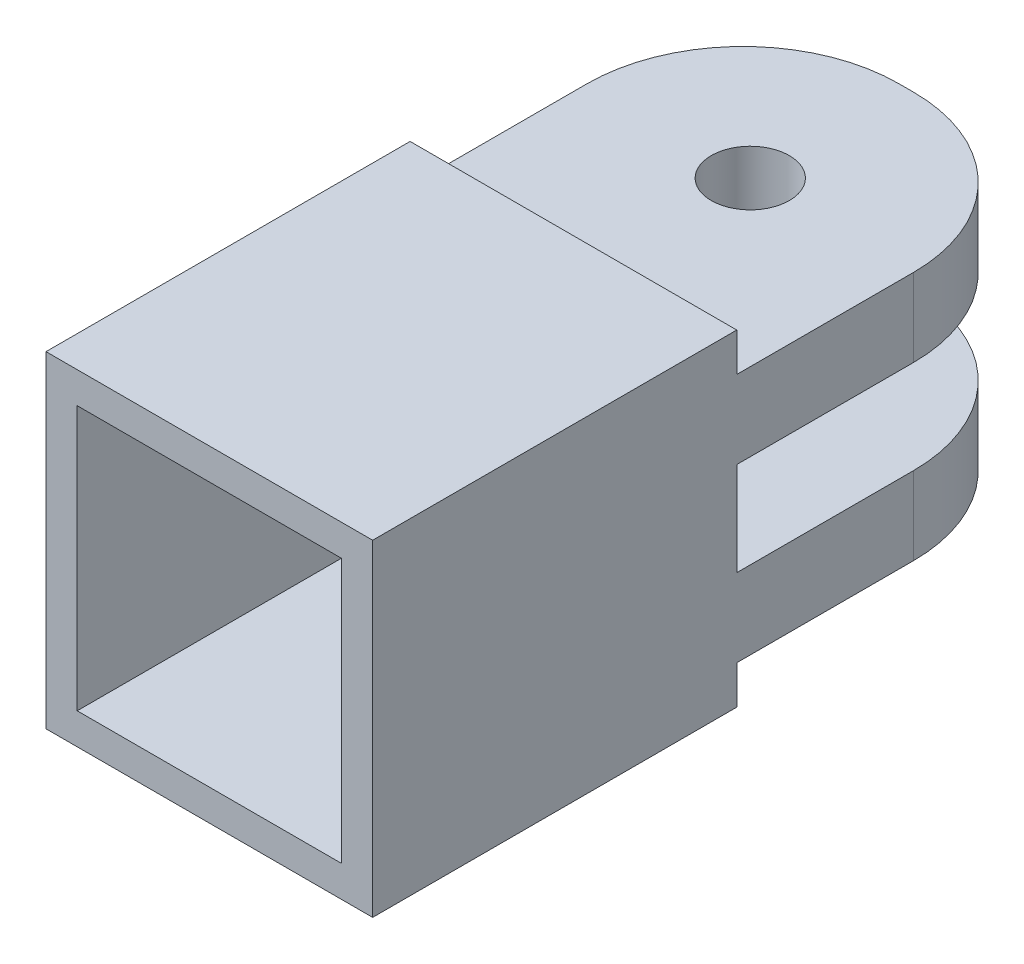
from build123d import *

# Parameters (mm, degrees)
SKETCH1_W           = 31.4
SKETCH1_H           = 31.4
SKETCH1_W_2         = 25.4
SKETCH1_H_2         = 25.4
BOSS_EXTRUDE1_DEPTH = 30
SKETCH2_W           = 31.4
SKETCH2_H           = 31.4
BOSS_EXTRUDE2_DEPTH = 5
SKETCH3_W           = 31.4
SKETCH3_H           = 7.5
BOSS_EXTRUDE3_DEPTH = 5
SKETCH6_R           = 3.75
BOSS_EXTRUDE6_DEPTH = 7.5


with BuildPart() as part:
    # Sketch1 → Boss-Extrude1 (new body)
    with BuildSketch(Plane.XY):
        Rectangle(SKETCH1_W, SKETCH1_H)
        Rectangle(SKETCH1_W_2, SKETCH1_H_2, mode=Mode.SUBTRACT)
    extrude(amount=BOSS_EXTRUDE1_DEPTH)

    # Sketch2 → Boss-Extrude2 (add)
    with BuildSketch(Plane(origin=(0, 0, 0), x_dir=(-1, 0, 0), z_dir=(0, 0, -1))):
        Rectangle(SKETCH2_W, SKETCH2_H)
    extrude(amount=BOSS_EXTRUDE2_DEPTH)

    # Sketch3 → Boss-Extrude3 (add)
    with BuildSketch(Plane(origin=(0, 0, -5), x_dir=(-1, 0, 0), z_dir=(0, 0, -1))):
        with Locations((0, 8.25)):
            Rectangle(SKETCH3_W, SKETCH3_H)
    boss_extrude3 = extrude(amount=BOSS_EXTRUDE3_DEPTH)

    # Sketch6 → Boss-Extrude6 (add)
    with BuildSketch(Plane(origin=(0, 12, 0), x_dir=(1, 0, 0), z_dir=(0, 1, 0))):
        with BuildLine():
            Line((-15.7, 10), (-15.7, 22))
            ThreePointArc((-15.7, 22), (-11.306601718, 32.606601718), (-0.7, 37))
            Line((-0.7, 37), (0.7, 37))
            ThreePointArc((0.7, 37), (11.306601718, 32.606601718), (15.7, 22))
            Line((15.7, 22), (15.7, 10))
            Line((15.7, 10), (-15.7, 10))
        make_face()
        with Locations(Location((0, 22, 0), (0, 0, 270))):
            Circle(SKETCH6_R, mode=Mode.SUBTRACT)
    boss_extrude6 = extrude(amount=-BOSS_EXTRUDE6_DEPTH)

    # Mirror1: Boss-Extrude3, Boss-Extrude6 across plane
    add(boss_extrude3.mirror(Plane.ZX))
    add(boss_extrude6.mirror(Plane.ZX))


solid = part.part
